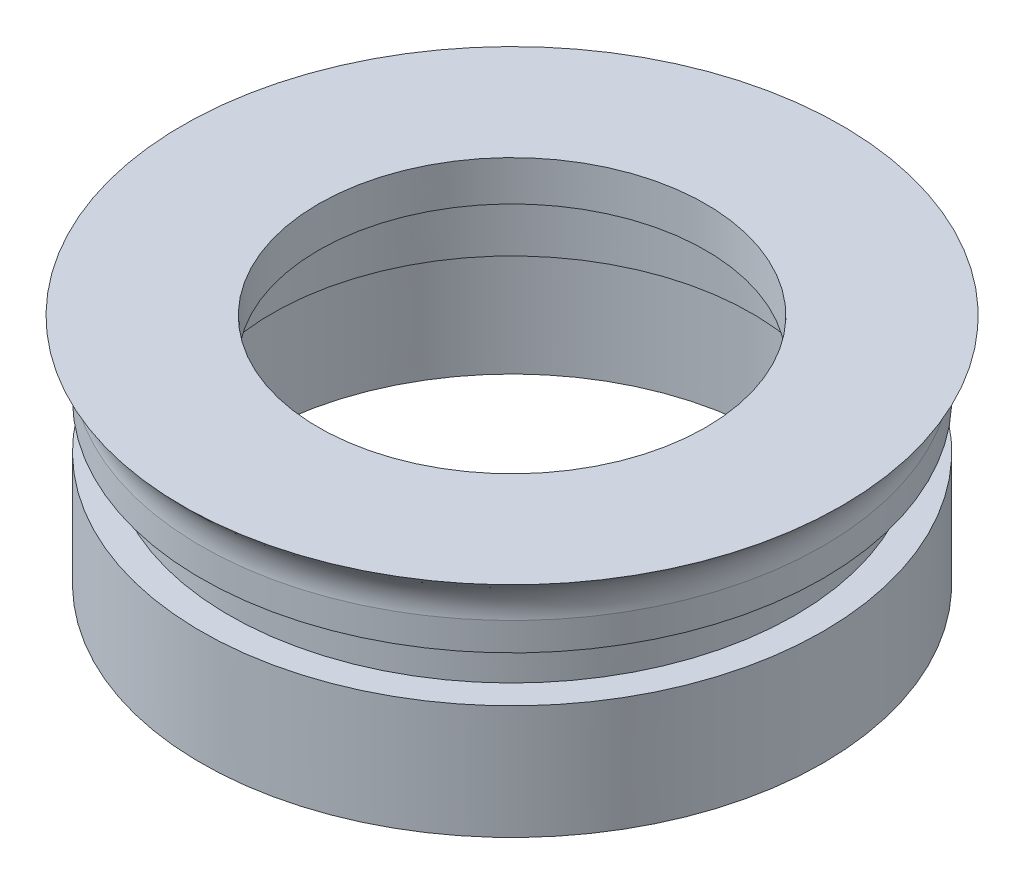
from build123d import *


with BuildPart() as part:
    # Çizim1 → Döndür1 (revolve)
    with BuildSketch(Plane.XY):
        with BuildLine():
            Line((20.004646073, 14.086412588), (11.752341824, 14.086412588))
            Line((11.752341824, 14.086412588), (11.752341824, 11.650520397))
            Line((11.752341824, 11.650520397), (14.556669151, 11.650520397))
            Line((14.556669151, 11.650520397), (14.556669151, 6.933061355))
            Line((14.556669151, 6.933061355), (15.5719338, 6.933061355))
            Line((15.5719338, 6.933061355), (15.584777069, -0.000761914))
            Line((15.584777069, -0.000761914), (18.86919695, -0.000761914))
            Line((18.86919695, -0.000761914), (18.86919695, 6.920968361))
            Line((18.86919695, 6.920968361), (17.172825705, 6.920968361))
            Line((17.172825705, 6.920968361), (17.172825705, 9.702776459))
            Line((17.172825705, 9.702776459), (18.86919695, 9.702776459))
            Line((18.86919695, 9.702776459), (18.86919695, 11.407018185))
            ThreePointArc((18.86919695, 11.407018185), (19.094887766, 12.891659302), (20.004646073, 14.086412588))
        make_face()
    revolve(axis=Axis((0, 0, 0), (4.8888323348096654e-05, 0.9999999988049659, 0)))


solid = part.part
